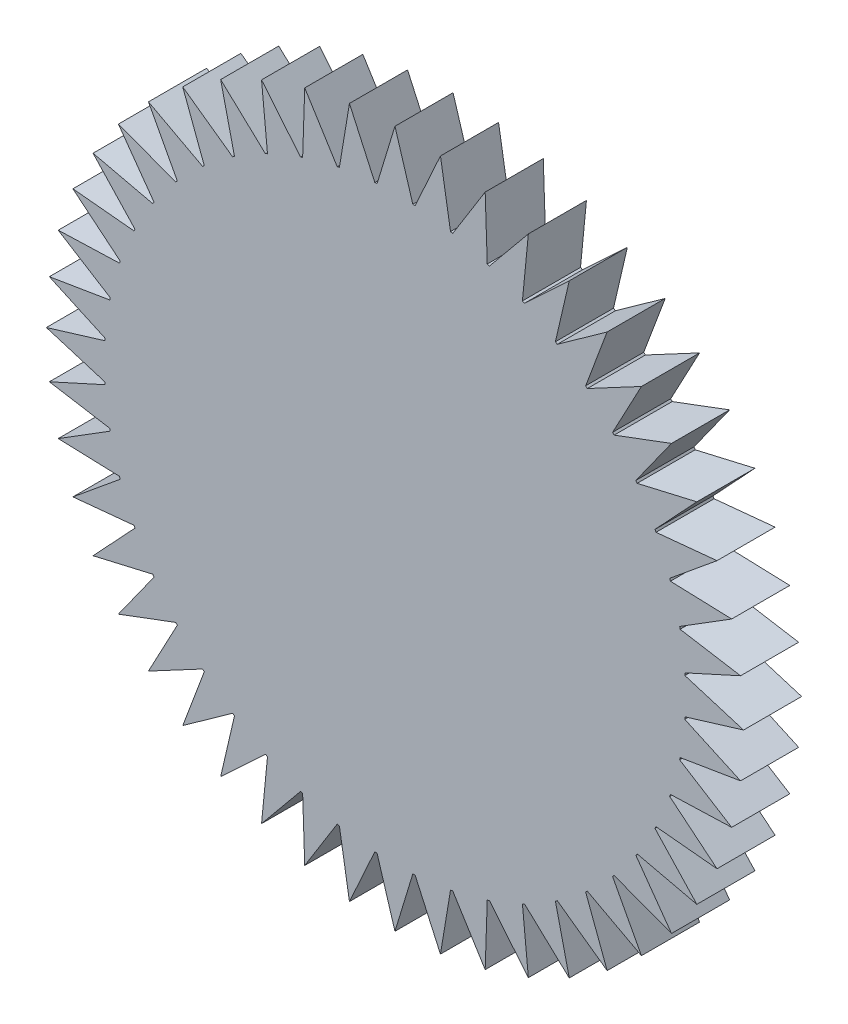
from build123d import *

# Parameters (mm, degrees)
ESQUISSE1_R             = 30
BOSS_EXTRU_1_DEPTH      = 5
ENL_V_START             = -5
ENL_V_MAT_EXTRU_1_DEPTH = 5


with BuildPart() as part:
    # Esquisse1 → Boss.-Extru.1 (new body)
    with BuildSketch(Plane.XY):
        Circle(ESQUISSE1_R)
    extrude(amount=BOSS_EXTRU_1_DEPTH)

    # Esquisse3 → Enlèv. mat.-Extru.1 (cut)
    with BuildSketch(Plane.XY.offset(5).offset(ENL_V_START)):
        with BuildLine():
            Line((-13.807943559, 20.840841986), (-15, 25.980762114))
            ThreePointArc((-15, 25.980762114), (-16.667106991, 24.944088369), (-18.26284287, 23.800600209))
            Line((-18.26284287, 23.800600209), (-13.970356116, 20.732321384))
            ThreePointArc((-13.970356116, 20.732321384), (-13.889255825, 20.786740308), (-13.807943559, 20.840841986))
        make_face()
        with BuildLine():
            Line((-16.410090434, 18.860247399), (-18.26284287, 23.800600209))
            ThreePointArc((-18.26284287, 23.800600209), (-19.780374453, 22.555194224), (-21.213203436, 21.213203436))
            Line((-21.213203436, 21.213203436), (-16.556948749, 18.731456113))
            ThreePointArc((-16.556948749, 18.731456113), (-16.483645378, 18.795995187), (-16.410090434, 18.860247399))
        make_face()
        with BuildLine():
            Line((-18.731456113, 16.556948749), (-21.213203436, 21.213203436))
            ThreePointArc((-21.213203436, 21.213203436), (-22.555194224, 19.780374453), (-23.800600209, 18.26284287))
            Line((-23.800600209, 18.26284287), (-18.860247399, 16.410090434))
            ThreePointArc((-18.860247399, 16.410090434), (-18.795995187, 16.483645378), (-18.731456113, 16.556948749))
        make_face()
        with BuildLine():
            Line((-20.732321384, 13.970356116), (-23.800600209, 18.26284287))
            ThreePointArc((-23.800600209, 18.26284287), (-24.944088369, 16.667106991), (-25.980762114, 15))
            Line((-25.980762114, 15), (-20.840841986, 13.807943559))
            ThreePointArc((-20.840841986, 13.807943559), (-20.786740308, 13.889255825), (-20.732321384, 13.970356116))
        make_face()
        with BuildLine():
            Line((-22.378450889, 11.144726817), (-25.980762114, 15))
            ThreePointArc((-25.980762114, 15), (-26.906182246, 13.268660707), (-27.716385975, 11.480502971))
            Line((-27.716385975, 11.480502971), (-22.464843989, 10.96953894))
            ThreePointArc((-22.464843989, 10.96953894), (-22.421818538, 11.057217255), (-22.378450889, 11.144726817))
        make_face()
        with BuildLine():
            Line((-23.641678894, 8.128408152), (-27.716385975, 11.480502971))
            ThreePointArc((-27.716385975, 11.480502971), (-28.407903885, 9.643183959), (-28.977774789, 7.764571353))
            Line((-28.977774789, 7.764571353), (-23.704466282, 7.943442469))
            ThreePointArc((-23.704466282, 7.943442469), (-23.673253237, 8.035986633), (-23.641678894, 8.128408152))
        make_face()
        with BuildLine():
            Line((-24.500391218, 4.973010169), (-28.977774789, 7.764571353))
            ThreePointArc((-28.977774789, 7.764571353), (-29.423558412, 5.85270966), (-29.743345841, 3.915785767))
            Line((-29.743345841, 3.915785767), (-24.538498586, 4.781431495))
            ThreePointArc((-24.538498586, 4.781431495), (-24.51963201, 4.87725805), (-24.500391218, 4.973010169))
        make_face()
        with BuildLine():
            Line((-24.939895056, 1.732522604), (-29.743345841, 3.915785767))
            ThreePointArc((-29.743345841, 3.915785767), (-29.935767697, 1.962093877), (-30, 0))
            Line((-30, 0), (-24.952670375, 1.537608903))
            ThreePointArc((-24.952670375, 1.537608903), (-24.946473081, 1.635078231), (-24.939895056, 1.732522604))
        make_face()
        with BuildLine():
            Line((-24.952670375, -1.537608903), (-30, 0))
            ThreePointArc((-30, 0), (-29.935767697, -1.962093877), (-29.743345841, -3.915785767))
            Line((-29.743345841, -3.915785767), (-24.939895056, -1.732522604))
            ThreePointArc((-24.939895056, -1.732522604), (-24.946473081, -1.635078231), (-24.952670375, -1.537608903))
        make_face()
        with BuildLine():
            Line((-24.538498586, -4.781431495), (-29.743345841, -3.915785767))
            ThreePointArc((-29.743345841, -3.915785767), (-29.423558412, -5.85270966), (-28.977774789, -7.764571353))
            Line((-28.977774789, -7.764571353), (-24.500391218, -4.973010169))
            ThreePointArc((-24.500391218, -4.973010169), (-24.51963201, -4.87725805), (-24.538498586, -4.781431495))
        make_face()
        with BuildLine():
            Line((-23.704466282, -7.943442469), (-28.977774789, -7.764571353))
            ThreePointArc((-28.977774789, -7.764571353), (-28.407903885, -9.643183959), (-27.716385975, -11.480502971))
            Line((-27.716385975, -11.480502971), (-23.641678894, -8.128408152))
            ThreePointArc((-23.641678894, -8.128408152), (-23.673253237, -8.035986633), (-23.704466282, -7.943442469))
        make_face()
        with BuildLine():
            Line((-22.464843989, -10.96953894), (-27.716385975, -11.480502971))
            ThreePointArc((-27.716385975, -11.480502971), (-26.906182246, -13.268660707), (-25.980762114, -15))
            Line((-25.980762114, -15), (-22.378450889, -11.144726817))
            ThreePointArc((-22.378450889, -11.144726817), (-22.421818538, -11.057217255), (-22.464843989, -10.96953894))
        make_face()
        with BuildLine():
            Line((-20.840841986, -13.807943559), (-25.980762114, -15))
            ThreePointArc((-25.980762114, -15), (-24.944088369, -16.667106991), (-23.800600209, -18.26284287))
            Line((-23.800600209, -18.26284287), (-20.732321384, -13.970356116))
            ThreePointArc((-20.732321384, -13.970356116), (-20.786740308, -13.889255825), (-20.840841986, -13.807943559))
        make_face()
        with BuildLine():
            Line((-18.860247399, -16.410090434), (-23.800600209, -18.26284287))
            ThreePointArc((-23.800600209, -18.26284287), (-22.555194224, -19.780374453), (-21.213203436, -21.213203436))
            Line((-21.213203436, -21.213203436), (-18.731456113, -16.556948749))
            ThreePointArc((-18.731456113, -16.556948749), (-18.795995187, -16.483645378), (-18.860247399, -16.410090434))
        make_face()
        with BuildLine():
            Line((-16.556948749, -18.731456113), (-21.213203436, -21.213203436))
            ThreePointArc((-21.213203436, -21.213203436), (-19.780374453, -22.555194224), (-18.26284287, -23.800600209))
            Line((-18.26284287, -23.800600209), (-16.410090434, -18.860247399))
            ThreePointArc((-16.410090434, -18.860247399), (-16.483645378, -18.795995187), (-16.556948749, -18.731456113))
        make_face()
        with BuildLine():
            Line((-13.970356116, -20.732321384), (-18.26284287, -23.800600209))
            ThreePointArc((-18.26284287, -23.800600209), (-16.667106991, -24.944088369), (-15, -25.980762114))
            Line((-15, -25.980762114), (-13.807943559, -20.840841986))
            ThreePointArc((-13.807943559, -20.840841986), (-13.889255825, -20.786740308), (-13.970356116, -20.732321384))
        make_face()
        with BuildLine():
            Line((-11.144726817, -22.378450889), (-15, -25.980762114))
            ThreePointArc((-15, -25.980762114), (-13.268660707, -26.906182246), (-11.480502971, -27.716385975))
            Line((-11.480502971, -27.716385975), (-10.96953894, -22.464843989))
            ThreePointArc((-10.96953894, -22.464843989), (-11.057217255, -22.421818538), (-11.144726817, -22.378450889))
        make_face()
        with BuildLine():
            Line((-8.128408152, -23.641678894), (-11.480502971, -27.716385975))
            ThreePointArc((-11.480502971, -27.716385975), (-9.643183959, -28.407903885), (-7.764571353, -28.977774789))
            Line((-7.764571353, -28.977774789), (-7.943442469, -23.704466282))
            ThreePointArc((-7.943442469, -23.704466282), (-8.035986633, -23.673253237), (-8.128408152, -23.641678894))
        make_face()
        with BuildLine():
            Line((-4.973010169, -24.500391218), (-7.764571353, -28.977774789))
            ThreePointArc((-7.764571353, -28.977774789), (-5.85270966, -29.423558412), (-3.915785767, -29.743345841))
            Line((-3.915785767, -29.743345841), (-4.781431495, -24.538498586))
            ThreePointArc((-4.781431495, -24.538498586), (-4.87725805, -24.51963201), (-4.973010169, -24.500391218))
        make_face()
        with BuildLine():
            Line((-1.732522604, -24.939895056), (-3.915785767, -29.743345841))
            ThreePointArc((-3.915785767, -29.743345841), (-1.962093877, -29.935767697), (0, -30))
            Line((0, -30), (-1.537608903, -24.952670375))
            ThreePointArc((-1.537608903, -24.952670375), (-1.635078231, -24.946473081), (-1.732522604, -24.939895056))
        make_face()
        with BuildLine():
            ThreePointArc((0, -30), (1.962093877, -29.935767697), (3.915785767, -29.743345841))
            Line((3.915785767, -29.743345841), (1.732522604, -24.939895056))
            ThreePointArc((1.732522604, -24.939895056), (1.635078231, -24.946473081), (1.537608903, -24.952670375))
            Line((1.537608903, -24.952670375), (0, -30))
        make_face()
        with BuildLine():
            ThreePointArc((3.915785767, -29.743345841), (5.85270966, -29.423558412), (7.764571353, -28.977774789))
            Line((7.764571353, -28.977774789), (4.973010169, -24.500391218))
            ThreePointArc((4.973010169, -24.500391218), (4.87725805, -24.51963201), (4.781431495, -24.538498586))
            Line((4.781431495, -24.538498586), (3.915785767, -29.743345841))
        make_face()
        with BuildLine():
            ThreePointArc((7.764571353, -28.977774789), (9.643183959, -28.407903885), (11.480502971, -27.716385975))
            Line((11.480502971, -27.716385975), (8.128408152, -23.641678894))
            ThreePointArc((8.128408152, -23.641678894), (8.035986633, -23.673253237), (7.943442469, -23.704466282))
            Line((7.943442469, -23.704466282), (7.764571353, -28.977774789))
        make_face()
        with BuildLine():
            ThreePointArc((11.480502971, -27.716385975), (13.268660707, -26.906182246), (15, -25.980762114))
            Line((15, -25.980762114), (11.144726817, -22.378450889))
            ThreePointArc((11.144726817, -22.378450889), (11.057217255, -22.421818538), (10.96953894, -22.464843989))
            Line((10.96953894, -22.464843989), (11.480502971, -27.716385975))
        make_face()
        with BuildLine():
            ThreePointArc((15, -25.980762114), (16.667106991, -24.944088369), (18.26284287, -23.800600209))
            Line((18.26284287, -23.800600209), (13.970356116, -20.732321384))
            ThreePointArc((13.970356116, -20.732321384), (13.889255825, -20.786740308), (13.807943559, -20.840841986))
            Line((13.807943559, -20.840841986), (15, -25.980762114))
        make_face()
        with BuildLine():
            ThreePointArc((18.26284287, -23.800600209), (19.780374453, -22.555194224), (21.213203436, -21.213203436))
            Line((21.213203436, -21.213203436), (16.556948749, -18.731456113))
            ThreePointArc((16.556948749, -18.731456113), (16.483645378, -18.795995187), (16.410090434, -18.860247399))
            Line((16.410090434, -18.860247399), (18.26284287, -23.800600209))
        make_face()
        with BuildLine():
            ThreePointArc((21.213203436, -21.213203436), (22.555194224, -19.780374453), (23.800600209, -18.26284287))
            Line((23.800600209, -18.26284287), (18.860247399, -16.410090434))
            ThreePointArc((18.860247399, -16.410090434), (18.795995187, -16.483645378), (18.731456113, -16.556948749))
            Line((18.731456113, -16.556948749), (21.213203436, -21.213203436))
        make_face()
        with BuildLine():
            ThreePointArc((23.800600209, -18.26284287), (24.944088369, -16.667106991), (25.980762114, -15))
            Line((25.980762114, -15), (20.840841986, -13.807943559))
            ThreePointArc((20.840841986, -13.807943559), (20.786740308, -13.889255825), (20.732321384, -13.970356116))
            Line((20.732321384, -13.970356116), (23.800600209, -18.26284287))
        make_face()
        with BuildLine():
            ThreePointArc((25.980762114, -15), (26.906182246, -13.268660707), (27.716385975, -11.480502971))
            Line((27.716385975, -11.480502971), (22.464843989, -10.96953894))
            ThreePointArc((22.464843989, -10.96953894), (22.421818538, -11.057217255), (22.378450889, -11.144726817))
            Line((22.378450889, -11.144726817), (25.980762114, -15))
        make_face()
        with BuildLine():
            ThreePointArc((27.716385975, -11.480502971), (28.407903885, -9.643183959), (28.977774789, -7.764571353))
            Line((28.977774789, -7.764571353), (23.704466282, -7.943442469))
            ThreePointArc((23.704466282, -7.943442469), (23.673253237, -8.035986633), (23.641678894, -8.128408152))
            Line((23.641678894, -8.128408152), (27.716385975, -11.480502971))
        make_face()
        with BuildLine():
            ThreePointArc((28.977774789, -7.764571353), (29.423558412, -5.85270966), (29.743345841, -3.915785767))
            Line((29.743345841, -3.915785767), (24.538498586, -4.781431495))
            ThreePointArc((24.538498586, -4.781431495), (24.51963201, -4.87725805), (24.500391218, -4.973010169))
            Line((24.500391218, -4.973010169), (28.977774789, -7.764571353))
        make_face()
        with BuildLine():
            ThreePointArc((29.743345841, -3.915785767), (29.935767697, -1.962093877), (30, 0))
            Line((30, 0), (24.952670375, -1.537608903))
            ThreePointArc((24.952670375, -1.537608903), (24.946473081, -1.635078231), (24.939895056, -1.732522604))
            Line((24.939895056, -1.732522604), (29.743345841, -3.915785767))
        make_face()
        with BuildLine():
            ThreePointArc((30, 0), (29.935767697, 1.962093877), (29.743345841, 3.915785767))
            Line((29.743345841, 3.915785767), (24.939895056, 1.732522604))
            ThreePointArc((24.939895056, 1.732522604), (24.946473081, 1.635078231), (24.952670375, 1.537608903))
            Line((24.952670375, 1.537608903), (30, 0))
        make_face()
        with BuildLine():
            ThreePointArc((29.743345841, 3.915785767), (29.423558412, 5.85270966), (28.977774789, 7.764571353))
            Line((28.977774789, 7.764571353), (24.500391218, 4.973010169))
            ThreePointArc((24.500391218, 4.973010169), (24.51963201, 4.87725805), (24.538498586, 4.781431495))
            Line((24.538498586, 4.781431495), (29.743345841, 3.915785767))
        make_face()
        with BuildLine():
            ThreePointArc((28.977774789, 7.764571353), (28.407903885, 9.643183959), (27.716385975, 11.480502971))
            Line((27.716385975, 11.480502971), (23.641678894, 8.128408152))
            ThreePointArc((23.641678894, 8.128408152), (23.673253237, 8.035986633), (23.704466282, 7.943442469))
            Line((23.704466282, 7.943442469), (28.977774789, 7.764571353))
        make_face()
        with BuildLine():
            ThreePointArc((27.716385975, 11.480502971), (26.906182246, 13.268660707), (25.980762114, 15))
            Line((25.980762114, 15), (22.378450889, 11.144726817))
            ThreePointArc((22.378450889, 11.144726817), (22.421818538, 11.057217255), (22.464843989, 10.96953894))
            Line((22.464843989, 10.96953894), (27.716385975, 11.480502971))
        make_face()
        with BuildLine():
            ThreePointArc((25.980762114, 15), (24.944088369, 16.667106991), (23.800600209, 18.26284287))
            Line((23.800600209, 18.26284287), (20.732321384, 13.970356116))
            ThreePointArc((20.732321384, 13.970356116), (20.786740308, 13.889255825), (20.840841986, 13.807943559))
            Line((20.840841986, 13.807943559), (25.980762114, 15))
        make_face()
        with BuildLine():
            ThreePointArc((23.800600209, 18.26284287), (22.555194224, 19.780374453), (21.213203436, 21.213203436))
            Line((21.213203436, 21.213203436), (18.731456113, 16.556948749))
            ThreePointArc((18.731456113, 16.556948749), (18.795995187, 16.483645378), (18.860247399, 16.410090434))
            Line((18.860247399, 16.410090434), (23.800600209, 18.26284287))
        make_face()
        with BuildLine():
            ThreePointArc((21.213203436, 21.213203436), (19.780374453, 22.555194224), (18.26284287, 23.800600209))
            Line((18.26284287, 23.800600209), (16.410090434, 18.860247399))
            ThreePointArc((16.410090434, 18.860247399), (16.483645378, 18.795995187), (16.556948749, 18.731456113))
            Line((16.556948749, 18.731456113), (21.213203436, 21.213203436))
        make_face()
        with BuildLine():
            ThreePointArc((18.26284287, 23.800600209), (16.667106991, 24.944088369), (15, 25.980762114))
            Line((15, 25.980762114), (13.807943559, 20.840841986))
            ThreePointArc((13.807943559, 20.840841986), (13.889255825, 20.786740308), (13.970356116, 20.732321384))
            Line((13.970356116, 20.732321384), (18.26284287, 23.800600209))
        make_face()
        with BuildLine():
            ThreePointArc((15, 25.980762114), (13.268660707, 26.906182246), (11.480502971, 27.716385975))
            Line((11.480502971, 27.716385975), (10.96953894, 22.464843989))
            ThreePointArc((10.96953894, 22.464843989), (11.057217255, 22.421818538), (11.144726817, 22.378450889))
            Line((11.144726817, 22.378450889), (15, 25.980762114))
        make_face()
        with BuildLine():
            ThreePointArc((11.480502971, 27.716385975), (9.643183959, 28.407903885), (7.764571353, 28.977774789))
            Line((7.764571353, 28.977774789), (7.943442469, 23.704466282))
            ThreePointArc((7.943442469, 23.704466282), (8.035986633, 23.673253237), (8.128408152, 23.641678894))
            Line((8.128408152, 23.641678894), (11.480502971, 27.716385975))
        make_face()
        with BuildLine():
            Line((-10.96953894, 22.464843989), (-11.480502971, 27.716385975))
            ThreePointArc((-11.480502971, 27.716385975), (-13.268660707, 26.906182246), (-15, 25.980762114))
            Line((-15, 25.980762114), (-11.144726817, 22.378450889))
            ThreePointArc((-11.144726817, 22.378450889), (-11.057217255, 22.421818538), (-10.96953894, 22.464843989))
        make_face()
        with BuildLine():
            Line((-7.943442469, 23.704466282), (-7.764571353, 28.977774789))
            ThreePointArc((-7.764571353, 28.977774789), (-9.643183959, 28.407903885), (-11.480502971, 27.716385975))
            Line((-11.480502971, 27.716385975), (-8.128408152, 23.641678894))
            ThreePointArc((-8.128408152, 23.641678894), (-8.035986633, 23.673253237), (-7.943442469, 23.704466282))
        make_face()
        with BuildLine():
            Line((-4.781431495, 24.538498586), (-3.915785767, 29.743345841))
            ThreePointArc((-3.915785767, 29.743345841), (-5.85270966, 29.423558412), (-7.764571353, 28.977774789))
            Line((-7.764571353, 28.977774789), (-4.973010169, 24.500391218))
            ThreePointArc((-4.973010169, 24.500391218), (-4.87725805, 24.51963201), (-4.781431495, 24.538498586))
        make_face()
        with BuildLine():
            Line((-1.537608903, 24.952670375), (0, 30))
            ThreePointArc((0, 30), (-1.962093877, 29.935767697), (-3.915785767, 29.743345841))
            Line((-3.915785767, 29.743345841), (-1.732522604, 24.939895056))
            ThreePointArc((-1.732522604, 24.939895056), (-1.635078231, 24.946473081), (-1.537608903, 24.952670375))
        make_face()
        with BuildLine():
            ThreePointArc((3.915785767, 29.743345841), (1.962093877, 29.935767697), (0, 30))
            Line((0, 30), (1.537608903, 24.952670375))
            ThreePointArc((1.537608903, 24.952670375), (1.635078231, 24.946473081), (1.732522604, 24.939895056))
            Line((1.732522604, 24.939895056), (3.915785767, 29.743345841))
        make_face()
        with BuildLine():
            ThreePointArc((7.764571353, 28.977774789), (5.85270966, 29.423558412), (3.915785767, 29.743345841))
            Line((3.915785767, 29.743345841), (4.781431495, 24.538498586))
            ThreePointArc((4.781431495, 24.538498586), (4.87725805, 24.51963201), (4.973010169, 24.500391218))
            Line((4.973010169, 24.500391218), (7.764571353, 28.977774789))
        make_face()
    extrude(amount=ENL_V_MAT_EXTRU_1_DEPTH, mode=Mode.SUBTRACT)


solid = part.part
